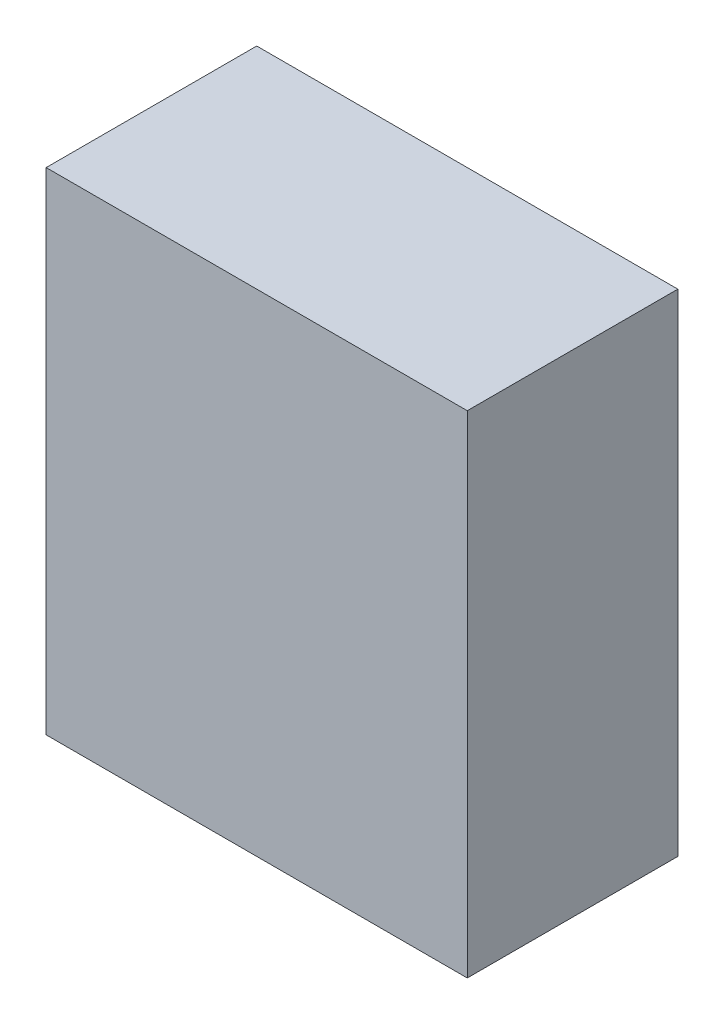
from build123d import *

# Parameters (mm, degrees)
SKETCH1_W           = 60
SKETCH1_H           = 70
BOSS_EXTRUDE1_DEPTH = 30
SHELL1_T            = 2.5


with BuildPart() as part:
    # Sketch1 → Boss-Extrude1 (new body)
    with BuildSketch(Plane.XY):
        Rectangle(SKETCH1_W, SKETCH1_H)
    extrude(amount=BOSS_EXTRUDE1_DEPTH)

    # Shell1 (no face opened: a closed hollow body)
    add(offset(amount=-SHELL1_T, mode=Mode.PRIVATE), mode=Mode.SUBTRACT)


solid = part.part
